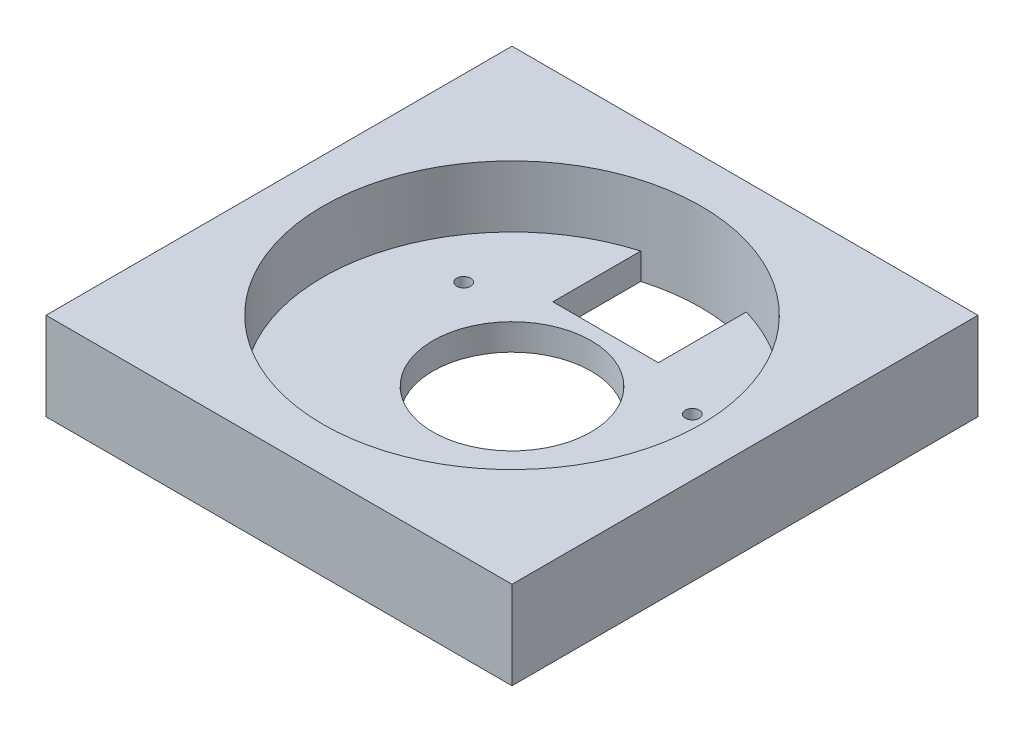
from build123d import *

# Parameters (mm, degrees)
SKETCH_1_W      = 53
SKETCH_1_H      = 53
SKETCH_1_R      = 21.5
EXTRUDE_1_DEPTH = 7
EXTRUDE_START   = 3
SKETCH_2_W      = 53
SKETCH_2_H      = 53
SKETCH_2_R      = 0.8
SKETCH_2_R_2    = 9
EXTRUDE_2_DEPTH = 3


with BuildPart() as part:
    # 草图1 → 凸台-拉伸1 (new body)
    with BuildSketch(Plane(origin=(0, 0, 0), x_dir=(1, 0, 0), z_dir=(0, 1, 0))):
        Rectangle(SKETCH_1_W, SKETCH_1_H)
        with Locations(Location((0, 0, 0), (0, 0, 270))):
            Circle(SKETCH_1_R, mode=Mode.SUBTRACT)
    extrude(amount=EXTRUDE_1_DEPTH)

    # 草图2 → 凸台-拉伸2 (add)
    with BuildSketch(Plane.XZ.offset(EXTRUDE_START)):
        Rectangle(SKETCH_2_W, SKETCH_2_H)
        with Locations(Location((-13, -7.505553499, 0), (0, 0, 270))):
            Circle(SKETCH_2_R, mode=Mode.SUBTRACT)
        with Locations(Location((0, 15.011106999, 0), (0, 0, 270))):
            Circle(SKETCH_2_R, mode=Mode.SUBTRACT)
        with Locations(Location((13, -7.505553499, 0), (0, 0, 270))):
            Circle(SKETCH_2_R, mode=Mode.SUBTRACT)
        with Locations(Location((0, 0, 0), (0, 0, 270))):
            Circle(SKETCH_2_R_2, mode=Mode.SUBTRACT)
        with BuildLine():
            Line((-6, -20.645822822), (-6, -10.645822822))
            Line((-6, -10.645822822), (6, -10.645822822))
            Line((6, -10.645822822), (6, -20.645822822))
            ThreePointArc((6, -20.645822822), (0, -21.5), (-6, -20.645822822))
        make_face(mode=Mode.SUBTRACT)
    extrude(amount=-EXTRUDE_2_DEPTH)


solid = part.part
